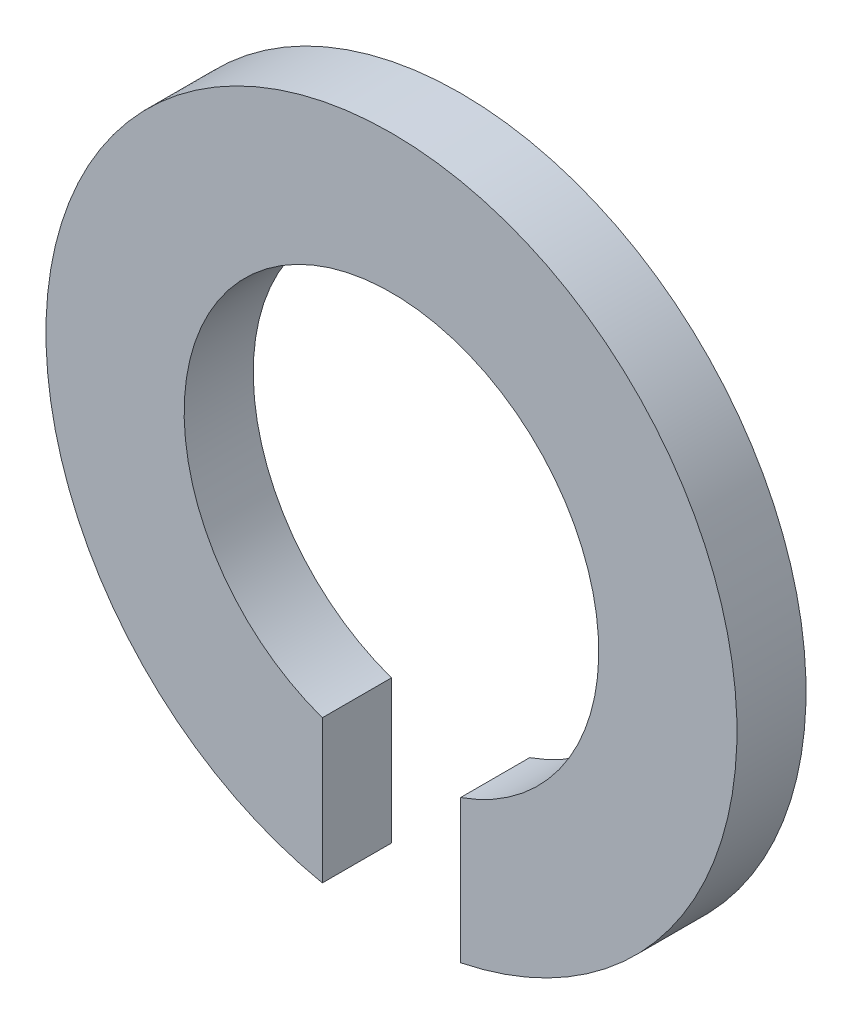
from build123d import *

# Parameters (mm, degrees)
BOSS_EXTRU_1_DEPTH = 0.5


with BuildPart() as part:
    # Esquisse2 → Boss.-Extru.1 (new body)
    with BuildSketch(Plane.XY):
        with BuildLine():
            Line((0.5, -2.449489743), (0.5, -1.414213562))
            ThreePointArc((0.5, -1.414213562), (0, 1.5), (-0.5, -1.414213562))
            Line((-0.5, -1.414213562), (-0.5, -2.449489743))
            ThreePointArc((-0.5, -2.449489743), (0, 2.5), (0.5, -2.449489743))
        make_face()
    extrude(amount=BOSS_EXTRU_1_DEPTH)


solid = part.part
